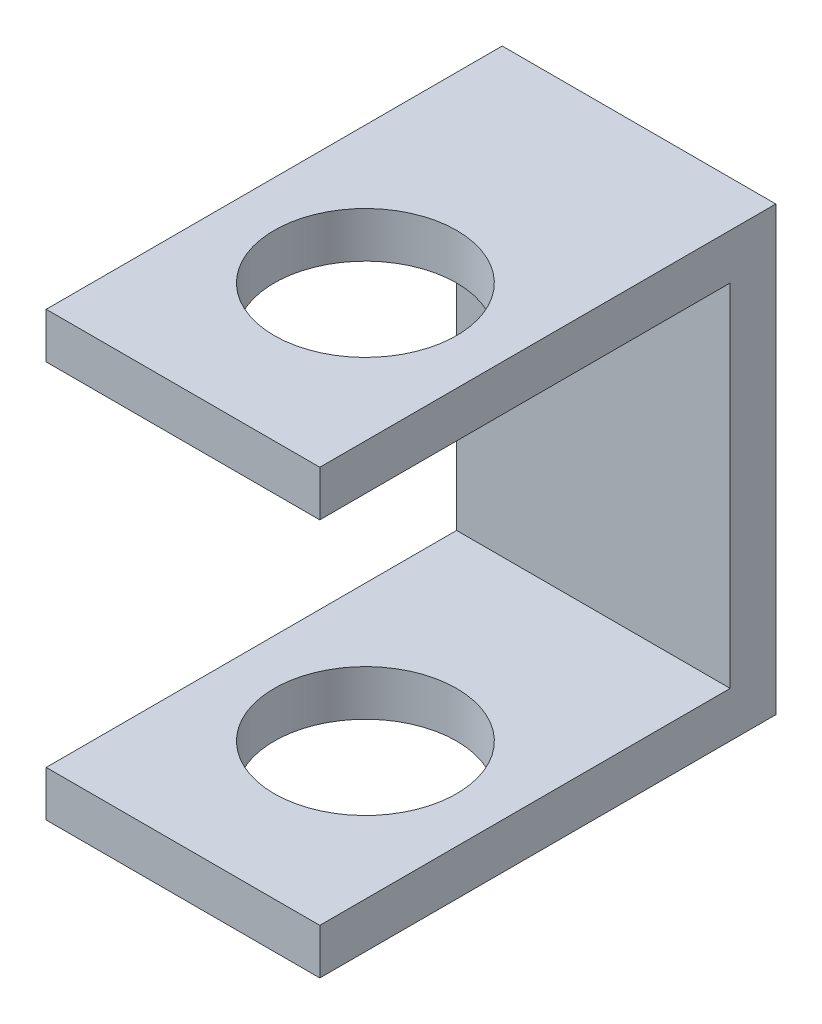
from build123d import *

# Parameters (mm, degrees)
BOSS_EXTRUDE1_DEPTH = 38.1
SKETCH3_R           = 12.7
CUT_EXTRUDE1_DEPTH  = 97.321358094


with BuildPart() as part:
    # Sketch2 → Boss-Extrude1 (new body)
    with BuildSketch(Plane(origin=(0, 0, 0), x_dir=(0, 0, -1), z_dir=(1, 0, 0))):
        Polygon((-63.5, 55.245), (-6.35, 55.245), (-6.35, 6.35), (-63.5, 6.35), (-63.5, 0), (0, 0), (0, 61.595), (-63.5, 61.595), align=None)
    extrude(amount=BOSS_EXTRUDE1_DEPTH)

    # Sketch3 → Cut-Extrude1 (cut, through all)
    with BuildSketch(Plane(origin=(0, 61.595, 0), x_dir=(1, 0, 0), z_dir=(0, 1, 0))):
        with Locations(Location((19.05, -38.1, 0), (0, 0, 270))):
            Circle(SKETCH3_R)
    extrude(amount=-CUT_EXTRUDE1_DEPTH, mode=Mode.SUBTRACT)


solid = part.part
